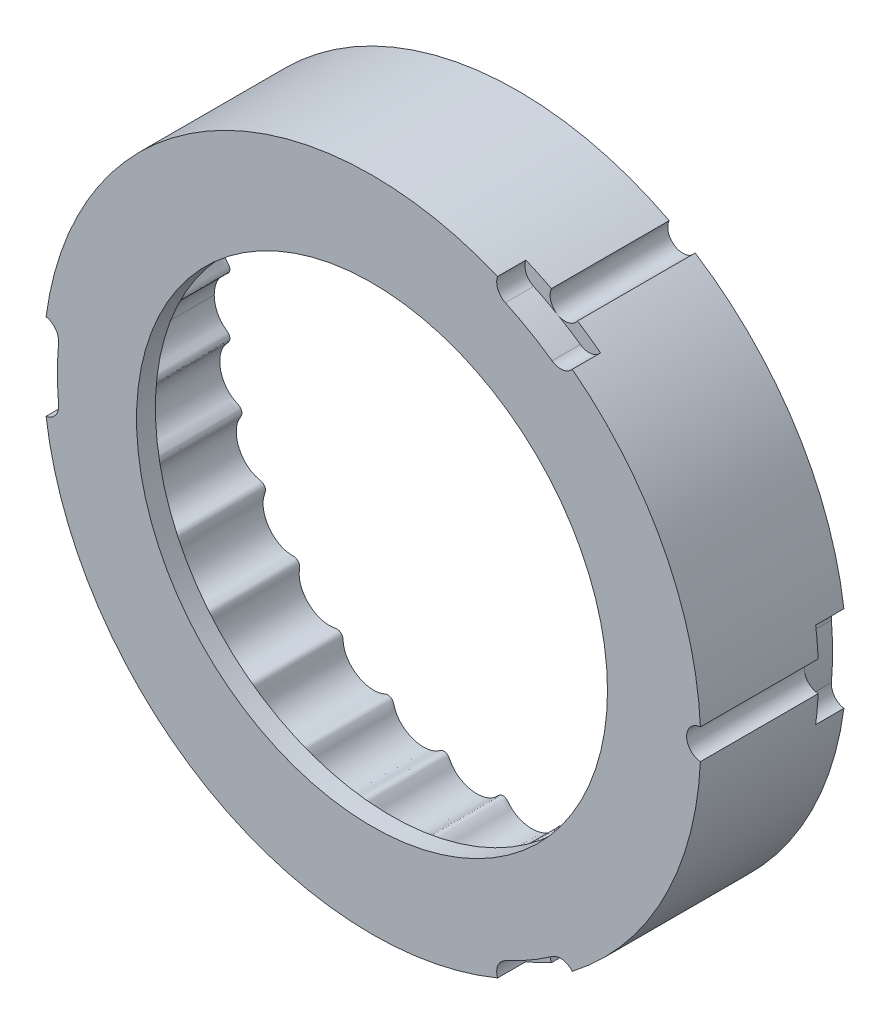
from build123d import *

# Parameters (mm, degrees)
ESQUISSE1_R             = 34.9
BOSS_EXTRU_1_DEPTH      = 13.5
ESQUISSE3_R             = 34.9
ESQUISSE3_R_2           = 25
BOSS_EXTRU_2_DEPTH      = 2
ESQUISSE4_R             = 1.6
ENL_V_MAT_EXTRU_2_DEPTH = 52.732678425
ENL_V_MAT_EXTRU_3_DEPTH = 3
ESQUISSE6_R             = 1.6
ENL_V_MAT_EXTRU_4_DEPTH = 52.732678425
ENL_V_START             = -3
ENL_V_MAT_EXTRU_5_DEPTH = 3


with BuildPart() as part:
    # Esquisse1 → Boss.-Extru.1 (new body)
    with BuildSketch(Plane.XY):
        Circle(ESQUISSE1_R)
        with BuildLine():
            add(Edge.make_bspline(
                [(30.75, 0), (30.75, -0.012466551), (30.750978291, -0.037435326), (30.755380523, -0.087337177), (30.767021407, -0.146605526), (30.784235638, -0.201639987), (30.806725403, -0.255918868), (30.840935147, -0.321123985), (30.887422434, -0.389111538), (30.947096406, -0.458089435), (31.018450958, -0.527969594), (31.087642774, -0.591592772), (31.173963904, -0.671262461), (31.275013947, -0.769628319), (31.418667793, -0.925049962), (31.590505656, -1.149287713), (31.765198528, -1.440584759), (31.922692534, -1.804453032), (32.034958648, -2.194853386), (32.098455422, -2.605847675), (32.110893976, -3.018484836), (32.074041221, -3.426596924), (31.989674774, -3.824502644), (31.859579575, -4.20675551), (31.685835108, -4.56634961), (31.470950798, -4.897742168), (31.24907067, -5.158368371), (31.037624658, -5.355859269), (30.846956876, -5.502834102), (30.686542549, -5.609708869), (30.511303765, -5.713032229), (30.327949226, -5.826454032), (30.173095555, -5.998578141), (30.093232003, -6.229100949), (30.110193836, -6.460044438), (30.200515583, -6.65648558), (30.319195295, -6.81880241), (30.429591873, -6.972377134), (30.556884573, -7.171669121), (30.686990471, -7.42432627), (30.81051827, -7.752064551), (30.902306801, -8.157965927), (30.939306602, -8.590969655), (30.91541063, -9.043225199), (30.833120238, -9.47917927), (30.698564824, -9.892214886), (30.517499761, -10.276882491), (30.295359778, -10.628695383), (30.03663758, -10.942013482), (29.746966061, -11.212937701), (29.470433337, -11.410145285), (29.223317503, -11.547196269), (29.007991406, -11.641437129), (28.831489277, -11.706780195), (28.642058234, -11.769172318), (28.450045732, -11.863081746), (28.288329456, -12.026987259), (28.210287752, -12.224918325), (28.20346133, -12.405406571), (28.236785614, -12.570096872), (28.293783104, -12.715821968), (28.367996779, -12.873214243), (28.441734352, -13.051374202), (28.519282743, -13.279422724), (28.585875989, -13.561168059), (28.625891413, -13.901400281), (28.620176022, -14.296757725), (28.564173119, -14.692691042), (28.458894502, -15.083143097), (28.307859188, -15.458096406), (28.113801834, -15.812569773), (27.879487833, -16.141681779), (27.607733235, -16.440542983), (27.304935504, -16.701120752), (26.975605605, -16.919348027), (26.668066278, -17.069716959), (26.395293942, -17.166332894), (26.161761798, -17.224796282), (25.972001086, -17.258905238), (25.77009755, -17.283912083), (25.556930978, -17.318589654), (25.348986278, -17.421268885), (25.189696924, -17.606062532), (25.120163479, -17.826984077), (25.130694209, -18.042573767), (25.176826858, -18.238110843), (25.216893076, -18.422953837), (25.254028667, -18.656404758), (25.272254044, -18.939939771), (25.254622928, -19.289611344), (25.176827173, -19.698288661), (25.038154347, -20.109986708), (24.836067152, -20.515105141), (24.583785661, -20.886782695), (24.287592504, -21.219855725), (23.953496641, -21.509650647), (23.587386146, -21.751686499), (23.210135668, -21.933657843), (22.873869304, -22.043643078), (22.591374487, -22.102148479), (22.325158766, -22.133594977), (22.101571409, -22.140706228), (21.878531137, -22.127472643), (21.64366765, -22.109610546), (21.438911553, -22.128790646), (21.235010271, -22.221372978), (21.072081402, -22.396691751), (20.993021331, -22.612875938), (20.985637564, -22.829397015), (20.992657275, -23.032781427), (20.989114789, -23.225634535), (20.969103016, -23.465571964), (20.917534051, -23.750425404), (20.818402107, -24.078217858), (20.655461136, -24.438354859), (20.446318236, -24.77898339), (20.131259913, -25.173976814), (19.681623457, -25.583288583), (19.159101878, -25.898679173), (18.590417327, -26.101603516), (18.101715984, -26.187940575), (17.759635951, -26.202985797), (17.470900281, -26.182588302), (17.23345446, -26.142771473), (17.045752759, -26.098427136), (16.850546694, -26.04105894), (16.639855437, -25.991807329), (16.410596194, -26.010096582), (16.197941083, -26.119984154), (16.054054554, -26.291655725), (15.981224755, -26.484264107), (15.946773384, -26.67216042), (15.913564985, -26.847713157), (15.871685839, -27.021430326), (15.818449071, -27.192101981), (15.738226672, -27.400602374), (15.563680399, -27.758482427), (15.294509879, -28.138551919), (14.917145191, -28.511493641), (14.463348217, -28.825916643), (14.067254883, -29.030313323), (13.644707988, -29.182609996), (13.202266996, -29.278018794), (12.769160471, -29.310447345), (12.354022164, -29.284747019), (12.010913039, -29.215435201), (11.740678008, -29.127800828), (11.523693584, -29.034133165), (11.354530851, -28.949519002), (11.177174481, -28.855377593), (10.972347739, -28.788140756), (10.740900032, -28.795902093), (10.520165877, -28.899715369), (10.365449548, -29.072753766), (10.276488974, -29.269813162), (10.202138665, -29.459209799), (10.122065567, -29.634640688), (10.007780433, -29.846547273), (9.846740686, -30.087038042), (9.624994499, -30.347917925), (9.257073915, -30.680872369), (8.748044271, -31.005547481), (8.178506642, -31.224841958), (7.579451288, -31.328982908), (7.074194818, -31.33558044), (6.676837151, -31.291826712), (6.292424803, -31.199581901), (5.972732278, -31.076737502), (5.716146602, -30.942666011), (5.514413234, -30.811214119), (5.359908708, -30.695731217), (5.203466143, -30.565531259), (5.026930794, -30.439720932), (4.806886962, -30.371834664), (4.568763859, -30.395570685), (4.371718028, -30.501884115), (4.232419886, -30.652981867), (4.127613713, -30.812483406), (4.027239219, -30.960328748), (3.919539933, -31.102873512), (3.802517078, -31.238030468), (3.645681729, -31.39708508), (3.342807108, -31.655393467), (2.850196764, -31.953463879), (2.236864317, -32.159554757), (1.57334615, -32.232200172), (1.015521856, -32.196526691), (0.571557429, -32.107674615), (0.161283705, -31.964658139), (-0.209217883, -31.775370602), (-0.496194196, -31.574729658), (-0.708889751, -31.386328198), (-0.870479972, -31.213757884), (-0.991906569, -31.068751011), (-1.118600595, -30.912755833), (-1.283802812, -30.77364241), (-1.50177773, -30.695368016), (-1.745288935, -30.710453884), (-1.952773559, -30.813794282), (-2.109935037, -30.9617471), (-2.253484059, -31.105903729), (-2.396791197, -31.234857562), (-2.586266177, -31.383358797), (-2.829905081, -31.53946165), (-3.137313102, -31.690050518), (-3.511638872, -31.816266932), (-3.903126981, -31.89558302), (-4.305796572, -31.92693373), (-4.709428249, -31.91017939), (-5.108431436, -31.846078498), (-5.497253612, -31.735420208), (-5.870273183, -31.579083817), (-6.217378252, -31.380436639), (-6.533152655, -31.142394658), (-6.777297144, -30.902023384), (-6.958914424, -30.676536915), (-7.091402356, -30.4753478), (-7.186885131, -30.30782225), (-7.265867953, -30.152740478), (-7.346855679, -30.018784595), (-7.457681197, -29.892404345), (-7.60553599, -29.788631328), (-7.810335103, -29.731112085), (-8.038593116, -29.760689184), (-8.229618994, -29.856257723), (-8.394816518, -29.9678965), (-8.554688939, -30.067243562), (-8.761219567, -30.179444188), (-9.021074936, -30.290468637), (-9.346448338, -30.387833531), (-9.738074935, -30.45039329), (-10.144176955, -30.462548242), (-10.558233153, -30.422238345), (-10.973080432, -30.329358), (-11.381841314, -30.182346239), (-11.776677722, -29.979979329), (-12.148584824, -29.721454636), (-12.467916496, -29.426609232), (-12.732187808, -29.105081948), (-12.915225976, -28.80641542), (-13.03487844, -28.548612507), (-13.114181552, -28.325794213), (-13.167788721, -28.144409516), (-13.22395419, -27.951277061), (-13.325570796, -27.760308071), (-13.499181016, -27.607119994), (-13.731038092, -27.531281103), (-13.961638649, -27.550325469), (-14.163155902, -27.626619217), (-14.352236725, -27.701671193), (-14.535020621, -27.762827079), (-14.768085048, -27.823174098), (-15.053755399, -27.868974691), (-15.395692291, -27.884288313), (-15.789188843, -27.850723971), (-16.278477536, -27.746331558), (-16.752840182, -27.560901205), (-17.194557572, -27.301468319), (-17.590716934, -26.97428386), (-17.87644948, -26.672015571), (-18.115919757, -26.343859054), (-18.306739131, -25.996227401), (-18.429482089, -25.679570016), (-18.501270208, -25.406255491), (-18.539399373, -25.174330622), (-18.558976893, -24.987108047), (-18.571760551, -24.78819228), (-18.61171465, -24.578519008), (-18.726239883, -24.378949606), (-18.895897533, -24.250627404), (-19.068047978, -24.195684752), (-19.235848336, -24.184165155), (-19.391500857, -24.201416651), (-19.562492555, -24.233940762), (-19.753354572, -24.26127601), (-19.993502931, -24.280111301), (-20.282978203, -24.275062722), (-20.62258955, -24.229742144), (-21.00431105, -24.126378447), (-21.374143581, -23.974062339), (-21.726452872, -23.775287984), (-22.052339004, -23.536012023), (-22.347665728, -23.260153139), (-22.608419903, -22.951625966), (-22.830585063, -22.614392221), (-23.008044532, -22.256577927), (-23.137966714, -21.883559883), (-23.207650802, -21.548434104), (-23.233868929, -21.260282098), (-23.232901154, -21.019548449), (-23.218935644, -20.827285344), (-23.19308791, -20.625499772), (-23.171395968, -20.410869823), (-23.21469466, -20.183284139), (-23.349964976, -19.980242783), (-23.544142607, -19.854031001), (-23.755029658, -19.806888177), (-23.955988469, -19.801799201), (-24.144986012, -19.794823888), (-24.380442174, -19.773074374), (-24.659723113, -19.720773466), (-25.102454644, -19.583748012), (-25.571923788, -19.333855047), (-26.003256706, -18.993006763), (-26.375870189, -18.571626824), (-26.625124857, -18.20215167), (-26.823075066, -17.806717527), (-26.966843844, -17.392192767), (-27.049756553, -16.981734052), (-27.073164572, -16.628783839), (-27.060044319, -16.340630955), (-27.030669176, -16.119187804), (-26.995774458, -15.943853854), (-26.949270457, -15.771357955), (-26.894033787, -15.601397958), (-26.831811628, -15.421030995), (-26.796169531, -15.21878135), (-26.830728435, -14.997622482), (-26.955806551, -14.793653857), (-27.143052722, -14.65948272), (-27.350369916, -14.595684207), (-27.549151744, -14.551819123), (-27.735133332, -14.500607364), (-27.96273584, -14.421993188), (-28.226061235, -14.301645035), (-28.519239284, -14.12455143), (-28.827934712, -13.877519508), (-29.106252012, -13.590487417), (-29.410945114, -13.187328958), (-29.648569421, -12.739752245), (-29.813457, -12.260672538), (-29.900219677, -11.763100346), (-29.920303758, -11.36407803), (-29.890631705, -10.970079215), (-29.820680989, -10.634943946), (-29.729600376, -10.360248477), (-29.632436108, -10.139979755), (-29.542989628, -9.969160834), (-29.438948985, -9.794318673), (-29.336710564, -9.603945127), (-29.292590558, -9.376156501), (-29.34341498, -9.137555324), (-29.477260018, -8.948550251), (-29.655010404, -8.826328968), (-29.837952398, -8.743428067), (-30.00852719, -8.661710233), (-30.215640088, -8.547820996), (-30.450678595, -8.388222873), (-30.715953105, -8.159786654), (-30.990944518, -7.847674225), (-31.231016889, -7.485674209), (-31.427032099, -7.077644595), (-31.565885953, -6.650463689), (-31.647333706, -6.212241917), (-31.671341992, -5.770595707), (-31.637967099, -5.332917719), (-31.550269505, -4.923309446), (-31.430833245, -4.590237023), (-31.303681047, -4.331264436), (-31.188262944, -4.139982886), (-31.086186829, -3.993222979), (-30.974688463, -3.853591969), (-30.856371815, -3.719709273), (-30.728634747, -3.577746879), (-30.619668631, -3.403178608), (-30.570027677, -3.184776013), (-30.611119827, -2.948973779), (-30.735347564, -2.755298657), (-30.902668511, -2.617892737), (-31.067663107, -2.498810148), (-31.217809804, -2.377731949), (-31.394966629, -2.21470965), (-31.588243327, -1.999182568), (-31.757029051, -1.761099309), (-31.899946191, -1.50432232), (-32.001745872, -1.278667082), (-32.072893478, -1.089795434), (-32.132225215, -0.897200595), (-32.179715684, -0.70082959), (-32.210893403, -0.527619645), (-32.230197764, -0.377050267), (-32.241336158, -0.25116251), (-32.247277005, -0.157631371), (-32.24950491, -0.064498225), (-32.25, -0.021409221), (-32.25, 0)],
                knots=[0.074164953, 0.074164953, 0.074164953, 0.074164953, 0.074164953, 0.07460362, 0.075042288, 0.075480956, 0.075919624, 0.076358291, 0.076796959, 0.077674294, 0.078376767, 0.07907924, 0.079781713, 0.080484186, 0.081889131, 0.083294077, 0.086103968, 0.088913859, 0.092014101, 0.095114343, 0.098214585, 0.101314828, 0.10432547, 0.107336113, 0.110346755, 0.113357398, 0.116234596, 0.119111795, 0.120550394, 0.121988994, 0.123427593, 0.124866193, 0.126640249, 0.128414306, 0.130187266, 0.131960225, 0.133373318, 0.13478641, 0.136199503, 0.137612595, 0.14043878, 0.143264965, 0.146639475, 0.150013985, 0.153388495, 0.156763005, 0.159864606, 0.162966207, 0.166067808, 0.169169409, 0.171979199, 0.17478899, 0.176193886, 0.177598781, 0.179003676, 0.180408572, 0.182166529, 0.183924486, 0.185705816, 0.186596481, 0.187487146, 0.188926547, 0.190365948, 0.191805349, 0.19324475, 0.196123553, 0.199002355, 0.202017429, 0.205032504, 0.208047579, 0.211062653, 0.214074396, 0.217086139, 0.220097882, 0.223109625, 0.225987087, 0.228864548, 0.230303278, 0.231742009, 0.23318074, 0.23461947, 0.23639559, 0.238171709, 0.239943897, 0.241716085, 0.243128759, 0.244541432, 0.245954105, 0.247366778, 0.250192125, 0.253017472, 0.256390807, 0.259764143, 0.263137479, 0.266510814, 0.269781576, 0.273052337, 0.276323099, 0.27959386, 0.282263597, 0.283598466, 0.284933335, 0.287603072, 0.288937941, 0.290272809, 0.291978349, 0.293683888, 0.295463294, 0.297242701, 0.298681812, 0.300120924, 0.301560035, 0.302999146, 0.305877369, 0.308755592, 0.311769369, 0.314783146, 0.317796922, 0.323823638, 0.329849516, 0.332862455, 0.335740475, 0.338618495, 0.340057505, 0.341496515, 0.342935526, 0.344374536, 0.346152362, 0.347930189, 0.349637201, 0.351344213, 0.352679183, 0.354014153, 0.355349122, 0.356684092, 0.358019062, 0.359354032, 0.362023971, 0.368567294, 0.371838956, 0.375110618, 0.378483109, 0.3818556, 0.385228091, 0.388600583, 0.391425519, 0.394250455, 0.395662923, 0.397075391, 0.398487859, 0.399900327, 0.401671575, 0.403442823, 0.40522, 0.406997176, 0.408436108, 0.409875039, 0.411313971, 0.412752903, 0.415630766, 0.418508629, 0.42152116, 0.427546223, 0.433572959, 0.436587163, 0.439601368, 0.442615573, 0.445493951, 0.44837233, 0.449811519, 0.451250708, 0.452689897, 0.454129086, 0.455909198, 0.457689309, 0.459393993, 0.461098678, 0.462433521, 0.463768363, 0.465103206, 0.466438049, 0.467772891, 0.469107734, 0.471777419, 0.47831802, 0.484858622, 0.488232362, 0.491606102, 0.494979843, 0.498353583, 0.50117918, 0.504004778, 0.505417576, 0.506830375, 0.508243174, 0.509655973, 0.511428503, 0.513201034, 0.514976523, 0.516752012, 0.518190677, 0.519629342, 0.521068008, 0.522506673, 0.525384003, 0.528261333, 0.531272698, 0.534284062, 0.537295427, 0.540306791, 0.543322305, 0.546337819, 0.549353334, 0.552368848, 0.555247889, 0.55812693, 0.559566451, 0.561005971, 0.562445492, 0.563885012, 0.564775961, 0.56566691, 0.567448808, 0.569205741, 0.570962674, 0.572367569, 0.573772465, 0.57517736, 0.576582255, 0.579392045, 0.582201836, 0.585302986, 0.588404136, 0.591505286, 0.594606436, 0.597981309, 0.601356181, 0.604731054, 0.608105927, 0.610932446, 0.613758965, 0.615172225, 0.616585485, 0.617998745, 0.619412004, 0.621185051, 0.622958098, 0.624731365, 0.626504633, 0.627943229, 0.629381826, 0.630820423, 0.63225902, 0.635136214, 0.638013408, 0.641023709, 0.64403401, 0.650054612, 0.653155309, 0.656256005, 0.659356702, 0.662457399, 0.665267223, 0.668077047, 0.669481959, 0.670886871, 0.672291783, 0.673696695, 0.675452531, 0.677208368, 0.678991564, 0.679883162, 0.68077476, 0.682214218, 0.683653677, 0.685093136, 0.686532595, 0.689411513, 0.69229043, 0.695306386, 0.698322342, 0.701338298, 0.704354253, 0.707365251, 0.710376248, 0.713387245, 0.716398242, 0.719275486, 0.722152729, 0.723591351, 0.725029973, 0.726468595, 0.727907217, 0.729682016, 0.731456816, 0.733229603, 0.735002391, 0.736415329, 0.737828268, 0.739241207, 0.740654145, 0.743480023, 0.7463059, 0.753054164, 0.756428296, 0.759802428, 0.763072262, 0.766342096, 0.76961193, 0.772881764, 0.77555143, 0.776886264, 0.778221097, 0.779555931, 0.780890764, 0.782225598, 0.783560431, 0.785264184, 0.786967936, 0.78874869, 0.790529443, 0.791968729, 0.793408015, 0.7948473, 0.796286586, 0.799165157, 0.802043728, 0.805058366, 0.808073004, 0.811087641, 0.817114411, 0.820126544, 0.823138676, 0.826150808, 0.829028446, 0.831906085, 0.833344904, 0.834783723, 0.836222542, 0.837661361, 0.839438045, 0.841214729, 0.842986489, 0.84475825, 0.846170813, 0.847583376, 0.848995939, 0.850408501, 0.853233627, 0.856058753, 0.859431672, 0.862804591, 0.86617751, 0.869550429, 0.872821645, 0.87609286, 0.879364076, 0.882635291, 0.885305113, 0.886640024, 0.887974936, 0.889309847, 0.890644758, 0.891979669, 0.89331458, 0.895020895, 0.896727211, 0.898505854, 0.900284498, 0.901723549, 0.903162601, 0.904601653, 0.906040705, 0.908918809, 0.911796913, 0.91330359, 0.914810268, 0.916316945, 0.917823622, 0.919330299, 0.920836976, 0.921590315, 0.922343654, 0.923096992, 0.923850331, 0.923850331, 0.923850331, 0.923850331, 0.923850331], degree=4))
            add(Edge.make_bspline(
                [(30.75, 0), (30.75, 0.012466551), (30.750978291, 0.037435326), (30.755380523, 0.087337177), (30.767021407, 0.146605526), (30.784235638, 0.201639987), (30.806725403, 0.255918868), (30.840935147, 0.321123985), (30.887422434, 0.389111538), (30.947096406, 0.458089435), (31.018450958, 0.527969594), (31.087642774, 0.591592772), (31.173963904, 0.671262461), (31.275013947, 0.769628319), (31.418667793, 0.925049962), (31.590505656, 1.149287713), (31.765198528, 1.440584759), (31.922692534, 1.804453032), (32.034958648, 2.194853386), (32.098455422, 2.605847675), (32.110893976, 3.018484836), (32.074041221, 3.426596924), (31.989674774, 3.824502644), (31.859579575, 4.20675551), (31.685835108, 4.566349611), (31.470950798, 4.897742168), (31.24907067, 5.158368371), (31.037624658, 5.355859269), (30.846956876, 5.502834102), (30.686542549, 5.609708869), (30.511303765, 5.713032229), (30.327949226, 5.826454032), (30.173095555, 5.998578141), (30.093232003, 6.229100949), (30.110193836, 6.460044438), (30.200515583, 6.65648558), (30.319195295, 6.81880241), (30.429591873, 6.972377134), (30.556884573, 7.171669121), (30.686990471, 7.42432627), (30.81051827, 7.752064551), (30.902306801, 8.157965927), (30.939306602, 8.590969655), (30.91541063, 9.043225199), (30.833120238, 9.47917927), (30.698564824, 9.892214886), (30.517499761, 10.276882491), (30.295359778, 10.628695384), (30.03663758, 10.942013482), (29.746966061, 11.212937701), (29.470433337, 11.410145285), (29.223317503, 11.547196269), (29.007991406, 11.641437129), (28.831489277, 11.706780195), (28.642058234, 11.769172318), (28.450045732, 11.863081747), (28.288329456, 12.026987259), (28.210287752, 12.224918325), (28.20346133, 12.405406571), (28.236785614, 12.570096872), (28.293783104, 12.715821968), (28.367996779, 12.873214243), (28.441734352, 13.051374202), (28.519282743, 13.279422724), (28.585875989, 13.561168059), (28.625891413, 13.901400281), (28.620176022, 14.296757725), (28.564173119, 14.692691042), (28.458894502, 15.083143097), (28.307859188, 15.458096406), (28.113801834, 15.812569773), (27.879487833, 16.141681779), (27.607733235, 16.440542983), (27.304935504, 16.701120752), (26.975605605, 16.919348027), (26.668066278, 17.069716959), (26.395293942, 17.166332894), (26.161761798, 17.224796282), (25.972001086, 17.258905238), (25.77009755, 17.283912083), (25.556930978, 17.318589654), (25.348986278, 17.421268885), (25.189696924, 17.606062532), (25.120163479, 17.826984077), (25.130694209, 18.042573767), (25.176826858, 18.238110843), (25.216893076, 18.422953837), (25.254028667, 18.656404758), (25.272254044, 18.939939771), (25.254622928, 19.289611344), (25.176827173, 19.698288661), (25.038154347, 20.109986708), (24.836067152, 20.515105141), (24.583785661, 20.886782695), (24.287592504, 21.219855725), (23.953496641, 21.509650647), (23.587386146, 21.751686499), (23.210135668, 21.933657843), (22.873869304, 22.043643078), (22.591374487, 22.102148479), (22.325158766, 22.133594977), (22.101571409, 22.140706228), (21.878531137, 22.127472643), (21.64366765, 22.109610546), (21.438911553, 22.128790646), (21.235010271, 22.221372978), (21.072081402, 22.396691751), (20.993021331, 22.612875938), (20.985637564, 22.829397015), (20.992657275, 23.032781427), (20.989114789, 23.225634535), (20.969103016, 23.465571964), (20.917534051, 23.750425404), (20.818402107, 24.078217858), (20.655461136, 24.438354859), (20.446318236, 24.77898339), (20.131259913, 25.173976814), (19.681623457, 25.583288583), (19.159101878, 25.898679173), (18.590417327, 26.101603516), (18.101715984, 26.187940575), (17.759635951, 26.202985797), (17.470900281, 26.182588302), (17.23345446, 26.142771473), (17.045752759, 26.098427136), (16.850546694, 26.04105894), (16.639855437, 25.991807329), (16.410596194, 26.010096582), (16.197941083, 26.119984154), (16.054054553, 26.291655725), (15.981224755, 26.484264107), (15.946773384, 26.67216042), (15.913564985, 26.847713157), (15.871685839, 27.021430326), (15.818449071, 27.192101981), (15.738226672, 27.400602374), (15.563680399, 27.758482427), (15.294509879, 28.138551919), (14.917145191, 28.511493641), (14.463348217, 28.825916643), (14.067254883, 29.030313323), (13.644707988, 29.182609996), (13.202266996, 29.278018794), (12.769160471, 29.310447345), (12.354022164, 29.284747019), (12.010913039, 29.215435201), (11.740678008, 29.127800828), (11.523693584, 29.034133165), (11.354530851, 28.949519002), (11.177174481, 28.855377593), (10.972347739, 28.788140756), (10.740900032, 28.795902093), (10.520165877, 28.899715369), (10.365449548, 29.072753766), (10.276488974, 29.269813162), (10.202138665, 29.459209799), (10.122065567, 29.634640688), (10.007780433, 29.846547273), (9.846740686, 30.087038042), (9.624994499, 30.347917925), (9.257073915, 30.680872369), (8.748044271, 31.005547481), (8.178506642, 31.224841958), (7.579451288, 31.328982908), (7.074194818, 31.33558044), (6.676837151, 31.291826712), (6.292424803, 31.199581901), (5.972732278, 31.076737502), (5.716146602, 30.942666011), (5.514413234, 30.811214119), (5.359908708, 30.695731217), (5.203466143, 30.565531259), (5.026930794, 30.439720932), (4.806886962, 30.371834664), (4.568763859, 30.395570685), (4.371718028, 30.501884115), (4.232419886, 30.652981867), (4.127613713, 30.812483406), (4.027239219, 30.960328748), (3.919539933, 31.102873512), (3.802517078, 31.238030468), (3.645681729, 31.39708508), (3.342807108, 31.655393467), (2.850196764, 31.953463879), (2.236864317, 32.159554757), (1.57334615, 32.232200172), (1.015521856, 32.196526691), (0.571557429, 32.107674615), (0.161283705, 31.964658139), (-0.209217883, 31.775370602), (-0.496194196, 31.574729658), (-0.708889751, 31.386328198), (-0.870479972, 31.213757884), (-0.991906569, 31.068751012), (-1.118600595, 30.912755833), (-1.283802812, 30.77364241), (-1.50177773, 30.695368016), (-1.745288935, 30.710453884), (-1.952773559, 30.813794282), (-2.109935037, 30.9617471), (-2.253484059, 31.105903729), (-2.396791197, 31.234857562), (-2.586266177, 31.383358797), (-2.829905082, 31.53946165), (-3.137313102, 31.690050518), (-3.511638872, 31.816266932), (-3.903126981, 31.89558302), (-4.305796572, 31.92693373), (-4.709428249, 31.91017939), (-5.108431436, 31.846078498), (-5.497253612, 31.735420208), (-5.870273183, 31.579083817), (-6.217378252, 31.380436639), (-6.533152655, 31.142394658), (-6.777297144, 30.902023384), (-6.958914424, 30.676536915), (-7.091402356, 30.4753478), (-7.186885131, 30.30782225), (-7.265867953, 30.152740478), (-7.346855679, 30.018784595), (-7.457681197, 29.892404345), (-7.60553599, 29.788631328), (-7.810335103, 29.731112085), (-8.038593116, 29.760689184), (-8.229618994, 29.856257723), (-8.394816518, 29.9678965), (-8.554688939, 30.067243562), (-8.761219567, 30.179444188), (-9.021074936, 30.290468637), (-9.346448338, 30.387833531), (-9.738074935, 30.45039329), (-10.144176955, 30.462548242), (-10.558233153, 30.422238345), (-10.973080432, 30.329358), (-11.381841314, 30.182346239), (-11.776677722, 29.979979329), (-12.148584824, 29.721454636), (-12.467916496, 29.426609232), (-12.732187808, 29.105081948), (-12.915225976, 28.80641542), (-13.03487844, 28.548612507), (-13.114181552, 28.325794213), (-13.167788721, 28.144409516), (-13.22395419, 27.951277061), (-13.325570796, 27.760308071), (-13.499181016, 27.607119994), (-13.731038092, 27.531281103), (-13.961638649, 27.550325469), (-14.163155902, 27.626619217), (-14.352236725, 27.701671193), (-14.535020621, 27.762827079), (-14.768085048, 27.823174098), (-15.053755399, 27.868974691), (-15.395692291, 27.884288313), (-15.789188843, 27.850723971), (-16.278477536, 27.746331558), (-16.752840182, 27.560901205), (-17.194557572, 27.301468319), (-17.590716934, 26.97428386), (-17.87644948, 26.672015571), (-18.115919757, 26.343859054), (-18.306739131, 25.996227401), (-18.429482089, 25.679570016), (-18.501270208, 25.406255491), (-18.539399373, 25.174330622), (-18.558976893, 24.987108047), (-18.571760551, 24.78819228), (-18.61171465, 24.578519008), (-18.726239883, 24.378949606), (-18.895897533, 24.250627404), (-19.068047978, 24.195684752), (-19.235848336, 24.184165155), (-19.391500857, 24.201416651), (-19.562492555, 24.233940762), (-19.753354572, 24.26127601), (-19.993502931, 24.280111301), (-20.282978203, 24.275062722), (-20.62258955, 24.229742144), (-21.00431105, 24.126378447), (-21.374143581, 23.974062339), (-21.726452872, 23.775287984), (-22.052339004, 23.536012023), (-22.347665728, 23.260153139), (-22.608419903, 22.951625966), (-22.830585063, 22.614392221), (-23.008044532, 22.256577927), (-23.137966714, 21.883559883), (-23.207650802, 21.548434104), (-23.233868929, 21.260282098), (-23.232901154, 21.019548449), (-23.218935644, 20.827285344), (-23.19308791, 20.625499772), (-23.171395968, 20.410869823), (-23.21469466, 20.183284139), (-23.349964976, 19.980242783), (-23.544142607, 19.854031001), (-23.755029658, 19.806888177), (-23.955988469, 19.801799201), (-24.144986012, 19.794823888), (-24.380442174, 19.773074374), (-24.659723113, 19.720773466), (-25.102454644, 19.583748012), (-25.571923788, 19.333855047), (-26.003256706, 18.993006763), (-26.375870189, 18.571626824), (-26.625124857, 18.20215167), (-26.823075066, 17.806717527), (-26.966843844, 17.392192767), (-27.049756553, 16.981734052), (-27.073164572, 16.628783839), (-27.060044319, 16.340630955), (-27.030669176, 16.119187804), (-26.995774458, 15.943853854), (-26.949270457, 15.771357955), (-26.894033787, 15.601397958), (-26.831811628, 15.421030995), (-26.796169531, 15.21878135), (-26.830728435, 14.997622482), (-26.955806551, 14.793653857), (-27.143052723, 14.65948272), (-27.350369916, 14.595684207), (-27.549151744, 14.551819123), (-27.735133332, 14.500607364), (-27.96273584, 14.421993188), (-28.226061235, 14.301645035), (-28.519239284, 14.12455143), (-28.827934712, 13.877519508), (-29.106252012, 13.590487417), (-29.410945114, 13.187328958), (-29.648569421, 12.739752245), (-29.813457, 12.260672538), (-29.900219677, 11.763100346), (-29.920303758, 11.36407803), (-29.890631705, 10.970079215), (-29.820680989, 10.634943946), (-29.729600376, 10.360248477), (-29.632436108, 10.139979755), (-29.542989628, 9.969160834), (-29.438948985, 9.794318673), (-29.336710564, 9.603945127), (-29.292590558, 9.376156501), (-29.34341498, 9.137555324), (-29.477260018, 8.948550251), (-29.655010404, 8.826328968), (-29.837952398, 8.743428067), (-30.00852719, 8.661710233), (-30.215640088, 8.547820996), (-30.450678595, 8.388222873), (-30.715953105, 8.159786654), (-30.990944518, 7.847674225), (-31.231016889, 7.485674209), (-31.427032099, 7.077644595), (-31.565885953, 6.650463689), (-31.647333706, 6.212241917), (-31.671341992, 5.770595707), (-31.637967099, 5.332917719), (-31.550269505, 4.923309446), (-31.430833245, 4.590237023), (-31.303681047, 4.331264436), (-31.188262944, 4.139982886), (-31.086186829, 3.993222979), (-30.974688463, 3.853591969), (-30.856371815, 3.719709273), (-30.728634747, 3.577746879), (-30.619668631, 3.403178608), (-30.570027677, 3.184776013), (-30.611119827, 2.948973779), (-30.735347564, 2.755298657), (-30.902668511, 2.617892737), (-31.067663107, 2.498810148), (-31.217809804, 2.377731949), (-31.394966629, 2.21470965), (-31.588243327, 1.999182568), (-31.757029051, 1.761099309), (-31.899946191, 1.50432232), (-32.001745872, 1.278667082), (-32.072893478, 1.089795434), (-32.132225215, 0.897200595), (-32.179715684, 0.70082959), (-32.210893403, 0.527619645), (-32.230197764, 0.377050267), (-32.241336158, 0.25116251), (-32.247277005, 0.157631371), (-32.24950491, 0.064498225), (-32.25, 0.021409221), (-32.25, 0)],
                knots=[0.074164953, 0.074164953, 0.074164953, 0.074164953, 0.074164953, 0.07460362, 0.075042288, 0.075480956, 0.075919624, 0.076358291, 0.076796959, 0.077674294, 0.078376767, 0.07907924, 0.079781713, 0.080484186, 0.081889131, 0.083294077, 0.086103968, 0.088913859, 0.092014101, 0.095114343, 0.098214585, 0.101314828, 0.10432547, 0.107336113, 0.110346755, 0.113357398, 0.116234596, 0.119111795, 0.120550394, 0.121988994, 0.123427593, 0.124866193, 0.126640249, 0.128414306, 0.130187266, 0.131960225, 0.133373318, 0.13478641, 0.136199503, 0.137612595, 0.14043878, 0.143264965, 0.146639475, 0.150013985, 0.153388495, 0.156763005, 0.159864606, 0.162966207, 0.166067808, 0.169169409, 0.171979199, 0.17478899, 0.176193886, 0.177598781, 0.179003676, 0.180408572, 0.182166529, 0.183924486, 0.185705816, 0.186596481, 0.187487146, 0.188926547, 0.190365948, 0.191805349, 0.19324475, 0.196123553, 0.199002355, 0.202017429, 0.205032504, 0.208047579, 0.211062653, 0.214074396, 0.217086139, 0.220097882, 0.223109625, 0.225987087, 0.228864548, 0.230303278, 0.231742009, 0.23318074, 0.23461947, 0.23639559, 0.238171709, 0.239943897, 0.241716085, 0.243128759, 0.244541432, 0.245954105, 0.247366778, 0.250192125, 0.253017472, 0.256390807, 0.259764143, 0.263137479, 0.266510814, 0.269781576, 0.273052337, 0.276323099, 0.27959386, 0.282263597, 0.283598466, 0.284933335, 0.287603072, 0.288937941, 0.290272809, 0.291978349, 0.293683888, 0.295463294, 0.297242701, 0.298681812, 0.300120924, 0.301560035, 0.302999146, 0.305877369, 0.308755592, 0.311769369, 0.314783146, 0.317796922, 0.323823638, 0.329849516, 0.332862455, 0.335740475, 0.338618495, 0.340057505, 0.341496515, 0.342935526, 0.344374536, 0.346152362, 0.347930189, 0.349637201, 0.351344213, 0.352679183, 0.354014153, 0.355349122, 0.356684092, 0.358019062, 0.359354032, 0.362023971, 0.368567294, 0.371838956, 0.375110618, 0.378483109, 0.3818556, 0.385228091, 0.388600583, 0.391425519, 0.394250455, 0.395662923, 0.397075391, 0.398487859, 0.399900327, 0.401671575, 0.403442823, 0.40522, 0.406997176, 0.408436108, 0.409875039, 0.411313971, 0.412752903, 0.415630766, 0.418508629, 0.42152116, 0.427546223, 0.433572959, 0.436587163, 0.439601368, 0.442615573, 0.445493951, 0.44837233, 0.449811519, 0.451250708, 0.452689897, 0.454129086, 0.455909198, 0.457689309, 0.459393993, 0.461098678, 0.462433521, 0.463768363, 0.465103206, 0.466438049, 0.467772891, 0.469107734, 0.471777419, 0.47831802, 0.484858622, 0.488232362, 0.491606102, 0.494979843, 0.498353583, 0.50117918, 0.504004778, 0.505417576, 0.506830375, 0.508243174, 0.509655973, 0.511428503, 0.513201034, 0.514976523, 0.516752012, 0.518190677, 0.519629342, 0.521068008, 0.522506673, 0.525384003, 0.528261333, 0.531272698, 0.534284062, 0.537295427, 0.540306791, 0.543322305, 0.546337819, 0.549353334, 0.552368848, 0.555247889, 0.55812693, 0.559566451, 0.561005971, 0.562445492, 0.563885012, 0.564775961, 0.56566691, 0.567448808, 0.569205741, 0.570962674, 0.572367569, 0.573772465, 0.57517736, 0.576582255, 0.579392045, 0.582201836, 0.585302986, 0.588404136, 0.591505286, 0.594606436, 0.597981309, 0.601356181, 0.604731054, 0.608105927, 0.610932446, 0.613758965, 0.615172225, 0.616585485, 0.617998745, 0.619412004, 0.621185051, 0.622958098, 0.624731365, 0.626504633, 0.627943229, 0.629381826, 0.630820423, 0.63225902, 0.635136214, 0.638013408, 0.641023709, 0.64403401, 0.650054612, 0.653155309, 0.656256005, 0.659356702, 0.662457399, 0.665267223, 0.668077047, 0.669481959, 0.670886871, 0.672291783, 0.673696695, 0.675452531, 0.677208368, 0.678991564, 0.679883162, 0.68077476, 0.682214218, 0.683653677, 0.685093136, 0.686532595, 0.689411513, 0.69229043, 0.695306386, 0.698322342, 0.701338298, 0.704354253, 0.707365251, 0.710376248, 0.713387245, 0.716398242, 0.719275486, 0.722152729, 0.723591351, 0.725029973, 0.726468595, 0.727907217, 0.729682016, 0.731456816, 0.733229603, 0.735002391, 0.736415329, 0.737828268, 0.739241207, 0.740654145, 0.743480023, 0.7463059, 0.753054164, 0.756428296, 0.759802428, 0.763072262, 0.766342096, 0.76961193, 0.772881764, 0.77555143, 0.776886264, 0.778221097, 0.779555931, 0.780890764, 0.782225598, 0.783560431, 0.785264184, 0.786967936, 0.78874869, 0.790529443, 0.791968729, 0.793408015, 0.7948473, 0.796286586, 0.799165157, 0.802043728, 0.805058366, 0.808073004, 0.811087641, 0.817114411, 0.820126544, 0.823138676, 0.826150808, 0.829028446, 0.831906085, 0.833344904, 0.834783723, 0.836222542, 0.837661361, 0.839438045, 0.841214729, 0.842986489, 0.84475825, 0.846170813, 0.847583376, 0.848995939, 0.850408501, 0.853233627, 0.856058753, 0.859431672, 0.862804591, 0.86617751, 0.869550429, 0.872821645, 0.87609286, 0.879364076, 0.882635291, 0.885305113, 0.886640024, 0.887974936, 0.889309847, 0.890644758, 0.891979669, 0.89331458, 0.895020895, 0.896727211, 0.898505854, 0.900284498, 0.901723549, 0.903162601, 0.904601653, 0.906040705, 0.908918809, 0.911796913, 0.91330359, 0.914810268, 0.916316945, 0.917823622, 0.919330299, 0.920836976, 0.921590315, 0.922343654, 0.923096992, 0.923850331, 0.923850331, 0.923850331, 0.923850331, 0.923850331], degree=4))
        make_face(mode=Mode.SUBTRACT)
    extrude(amount=BOSS_EXTRU_1_DEPTH)

    # Esquisse3 → Boss.-Extru.2 (add)
    with BuildSketch(Plane.XY.offset(13.5)):
        Circle(ESQUISSE3_R)
        Circle(ESQUISSE3_R_2, mode=Mode.SUBTRACT)
    extrude(amount=BOSS_EXTRU_2_DEPTH)

    # Esquisse4 → Enlèv. mat.-Extru.2 (cut, through all)
    with BuildSketch(Plane.XY.offset(15.5)):
        with Locations((-35, 0)):
            Circle(ESQUISSE4_R)
        with Locations((17.5, 30.310889132)):
            Circle(ESQUISSE4_R)
        with Locations((17.5, -30.310889132)):
            Circle(ESQUISSE4_R)
    extrude(amount=-ENL_V_MAT_EXTRU_2_DEPTH, mode=Mode.SUBTRACT)

    # Esquisse5 → Enlèv. mat.-Extru.3 (cut)
    with BuildSketch(Plane.XY.offset(15.5)):
        with BuildLine():
            ThreePointArc((-34.971861739, 1.403170168), (-35, 0), (-34.971861739, -1.403170168))
            ThreePointArc((-34.971861739, -1.403170168), (-35.915348307, -4.212326962), (-33.277079935, -2.862857143))
            ThreePointArc((-33.277079935, -2.862857143), (-33.4, 0), (-33.277079935, 2.862857143))
            ThreePointArc((-33.277079935, 2.862857143), (-35.915348307, 4.212326962), (-34.971861739, 1.403170168))
        make_face()
        with BuildLine():
            ThreePointArc((14.159232954, 30.250225159), (14.309691996, 33.209767501), (16.270749858, 30.988105767))
            ThreePointArc((16.270749858, 30.988105767), (17.5, 30.310889132), (18.701111881, 29.5849356))
            ThreePointArc((18.701111881, 29.5849356), (21.605656312, 28.997440539), (19.11784698, 27.387368016))
            ThreePointArc((19.11784698, 27.387368016), (16.7, 28.925248486), (14.159232954, 30.250225159))
        make_face()
        with BuildLine():
            ThreePointArc((19.11784698, -27.387368016), (21.605656312, -28.997440539), (18.701111881, -29.5849356))
            ThreePointArc((18.701111881, -29.5849356), (17.5, -30.310889132), (16.270749858, -30.988105767))
            ThreePointArc((16.270749858, -30.988105767), (14.309691996, -33.209767501), (14.159232954, -30.250225159))
            ThreePointArc((14.159232954, -30.250225159), (16.7, -28.925248486), (19.11784698, -27.387368016))
        make_face()
    extrude(amount=-ENL_V_MAT_EXTRU_3_DEPTH, mode=Mode.SUBTRACT)

    # Esquisse6 → Enlèv. mat.-Extru.4 (cut, through all)
    with BuildSketch(Plane.XY.offset(15.5)):
        with Locations((35, 0)):
            Circle(ESQUISSE6_R)
    extrude(amount=-ENL_V_MAT_EXTRU_4_DEPTH, mode=Mode.SUBTRACT)

    # Esquisse7 → Enlèv. mat.-Extru.5 (cut)
    with BuildSketch(Plane(origin=(0, 0, 0), x_dir=(-1, 0, 0), z_dir=(0, 0, -1)).offset(ENL_V_START)):
        with BuildLine():
            ThreePointArc((-34.971861739, 1.403170168), (-35, 0), (-34.971861739, -1.403170168))
            ThreePointArc((-34.971861739, -1.403170168), (-35.915348307, -4.212326962), (-33.277079935, -2.862857143))
            ThreePointArc((-33.277079935, -2.862857143), (-33.4, 0), (-33.277079935, 2.862857143))
            ThreePointArc((-33.277079935, 2.862857143), (-35.915348307, 4.212326962), (-34.971861739, 1.403170168))
        make_face()
    extrude(amount=ENL_V_MAT_EXTRU_5_DEPTH, mode=Mode.SUBTRACT)


solid = part.part
